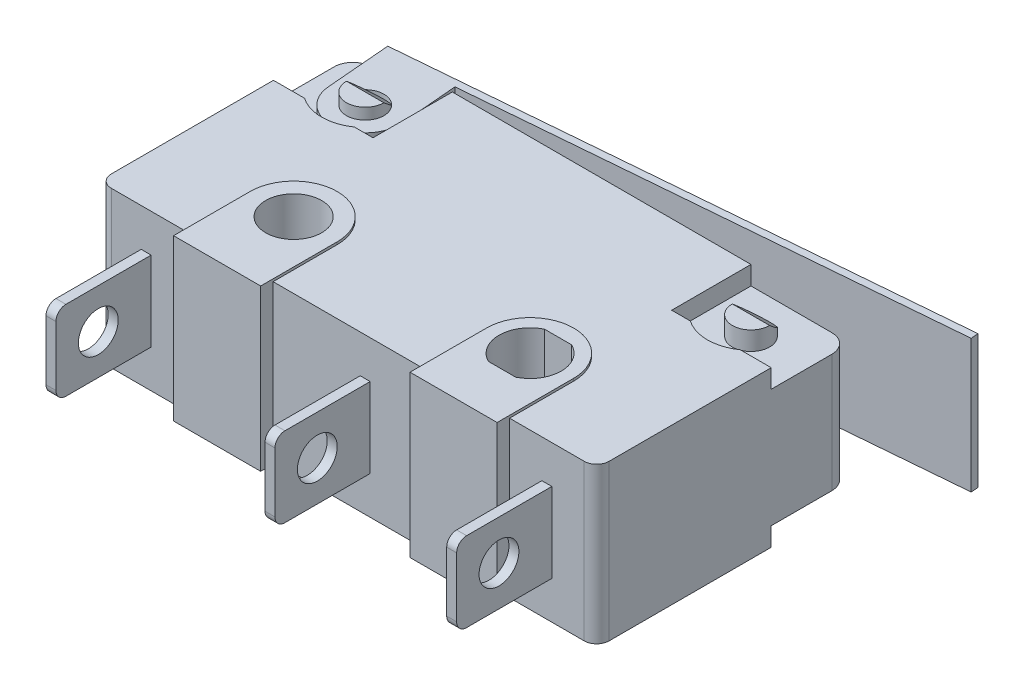
from build123d import *

# Parameters (mm, degrees)
SKETCH1_W             = 20
SKETCH1_H             = 10.2
BOSS_EXTRUDE1_DEPTH   = 6.25
FILLET1_R             = 0.75
FILLET2_R             = 0.5
SKETCH2_R             = 1.125
CUT_EXTRUDE1_DEPTH    = 13.848054327
BOSS_EXTRUDE2_START   = -6.35
SKETCH3_R             = 1.125
BOSS_EXTRUDE2_DEPTH   = 6.45
SKETCH4_R             = 0.75
CUT_EXTRUDE2_DEPTH    = 0.75
CUT_EXTRUDE3_START    = -5.5
SKETCH4_4_R           = 0.75
CUT_EXTRUDE3_DEPTH    = 0.75
CUT_EXTRUDE4_REACH    = 23.718
CUT_EXTRUDE5_START    = -16
CUT_EXTRUDE5_DEPTH    = 4
BOSS_EXTRUDE4_DEPTH   = 1.5
BOSS_EXTRUDE5_START   = 0.3
BOSS_EXTRUDE5_DEPTH   = 5.35
SKETCH10_W            = 0.4
SKETCH10_H            = 3.825
BOSS_EXTRUDE6_DEPTH   = 1.6
BOSS_EXTRUDE6_2_DEPTH = 1.6
BOSS_EXTRUDE6_3_DEPTH = 1.6
SKETCH11_R            = 0.8
CUT_EXTRUDE8_DEPTH    = 24.547231287


with BuildPart() as part:
    # Sketch1 → Boss-Extrude1 (new body)
    with BuildSketch(Plane(origin=(0, 0, 0), x_dir=(1, 0, 0), z_dir=(0, 1, 0))):
        Rectangle(SKETCH1_W, SKETCH1_H)
    extrude(amount=BOSS_EXTRUDE1_DEPTH)

    # Fillet1
    fillet1_edges = [part.edges().sort_by_distance(p)[0] for p in [
        (-10, 3.125, -5.1),
        (10, 3.125, -5.1),
    ]]
    fillet(fillet1_edges, radius=FILLET1_R)

    # Fillet2
    fillet2_edges = [part.edges().sort_by_distance(p)[0] for p in [
        (10, 3.125, 5.1),
        (-10, 3.125, 5.1),
    ]]
    fillet(fillet2_edges, radius=FILLET2_R)

    # Sketch2 → Cut-Extrude1 (cut, through all)
    with BuildSketch(Plane(origin=(0, 6.25, 0), x_dir=(1, 0, 0), z_dir=(0, 1, 0))):
        with Locations(Location((-4.75, -2.525, 0), (0, 0, 270))):
            Circle(SKETCH2_R)
        with BuildLine():
            Line((5.294862368, -1.4), (4.205137632, -1.4))
            ThreePointArc((4.205137632, -1.4), (3.5, -2.525), (4.205137632, -3.65))
            Line((4.205137632, -3.65), (5.294862368, -3.65))
            ThreePointArc((5.294862368, -3.65), (6, -2.525), (5.294862368, -1.4))
        make_face()
    extrude(amount=-CUT_EXTRUDE1_DEPTH, mode=Mode.SUBTRACT)

    # Sketch3 → Boss-Extrude2 (add)
    # profile 1 of 2: a face of its own
    with BuildSketch(Plane(origin=(0, 6.25, 0), x_dir=(1, 0, 0), z_dir=(0, 1, 0)).offset(BOSS_EXTRUDE2_START)):
        with BuildLine():
            Line((-6.5, -5.1), (-6.5, -2.525))
            ThreePointArc((-6.5, -2.525), (-4.75, -0.775), (-3, -2.525))
            Line((-3, -2.525), (-3, -5.1))
            Line((-3, -5.1), (-3, -5.6))
            Line((-3, -5.6), (-6.5, -5.6))
            Line((-6.5, -5.6), (-6.5, -5.1))
        make_face()
        with Locations(Location((-4.75, -2.525, 0), (0, 0, 270))):
            Circle(SKETCH3_R, mode=Mode.SUBTRACT)
    # profile 2 of 2: a face of its own
    with BuildSketch(Plane(origin=(0, 6.25, 0), x_dir=(1, 0, 0), z_dir=(0, 1, 0)).offset(BOSS_EXTRUDE2_START)):
        with BuildLine():
            Line((6.5, -5.6), (6.5, -5.1))
            Line((6.5, -5.1), (6.5, -2.525))
            ThreePointArc((6.5, -2.525), (4.75, -0.775), (3, -2.525))
            Line((3, -2.525), (3, -5.1))
            Line((3, -5.1), (3, -5.6))
            Line((3, -5.6), (6.5, -5.6))
        make_face()
        with BuildLine():
            Line((4.205137632, -3.65), (5.294862368, -3.65))
            ThreePointArc((5.294862368, -3.65), (6, -2.525), (5.294862368, -1.4))
            Line((5.294862368, -1.4), (4.205137632, -1.4))
            ThreePointArc((4.205137632, -1.4), (3.5, -2.525), (4.205137632, -3.65))
        make_face(mode=Mode.SUBTRACT)
    extrude(amount=BOSS_EXTRUDE2_DEPTH)

    # Sketch4 → Cut-Extrude2 (cut)
    # profile 1 of 2: a face of its own
    with BuildSketch(Plane(origin=(0, 6.25, 0), x_dir=(1, 0, 0), z_dir=(0, 1, 0))):
        with BuildLine():
            Line((-6, 1.913859338), (-6, 5.1))
            Line((-6, 5.1), (-9.25, 5.1))
            ThreePointArc((-9.25, 5.1), (-9.780330086, 4.880330086), (-10, 4.35))
            Line((-10, 4.35), (-10, 1.913859338))
            Line((-10, 1.913859338), (-8.75, 1.913859338))
            ThreePointArc((-8.75, 1.913859338), (-7.75, 1.6), (-6.75, 1.913859338))
            Line((-6.75, 1.913859338), (-6, 1.913859338))
        make_face()
        with Locations(Location((-7.75, 3.35, 0), (0, 0, 270))):
            Circle(SKETCH4_R, mode=Mode.SUBTRACT)
    # profile 2 of 2: a face of its own
    with BuildSketch(Plane(origin=(0, 6.25, 0), x_dir=(1, 0, 0), z_dir=(0, 1, 0))):
        with BuildLine():
            Line((9.25, 5.1), (6, 5.1))
            Line((6, 5.1), (6, 1.913859338))
            Line((6, 1.913859338), (6.75, 1.913859338))
            ThreePointArc((6.75, 1.913859338), (7.75, 1.6), (8.75, 1.913859338))
            Line((8.75, 1.913859338), (10, 1.913859338))
            Line((10, 1.913859338), (10, 4.35))
            ThreePointArc((10, 4.35), (9.780330086, 4.880330086), (9.25, 5.1))
        make_face()
        with Locations(Location((7.75, 3.35, 0), (0, 0, 270))):
            Circle(SKETCH4_R, mode=Mode.SUBTRACT)
    extrude(amount=-CUT_EXTRUDE2_DEPTH, mode=Mode.SUBTRACT)

    # Sketch4<4> → Cut-Extrude3 (cut)
    # profile 1 of 2: a face of its own
    with BuildSketch(Plane(origin=(0, 6.25, 0), x_dir=(1, 0, 0), z_dir=(0, 1, 0)).offset(CUT_EXTRUDE3_START)):
        with BuildLine():
            Line((-6, 1.913859338), (-6, 5.1))
            Line((-6, 5.1), (-9.25, 5.1))
            ThreePointArc((-9.25, 5.1), (-9.780330086, 4.880330086), (-10, 4.35))
            Line((-10, 4.35), (-10, 1.913859338))
            Line((-10, 1.913859338), (-8.75, 1.913859338))
            ThreePointArc((-8.75, 1.913859338), (-7.75, 1.6), (-6.75, 1.913859338))
            Line((-6.75, 1.913859338), (-6, 1.913859338))
        make_face()
        with Locations(Location((-7.75, 3.35, 0), (0, 0, 270))):
            Circle(SKETCH4_4_R, mode=Mode.SUBTRACT)
    # profile 2 of 2: a face of its own
    with BuildSketch(Plane(origin=(0, 6.25, 0), x_dir=(1, 0, 0), z_dir=(0, 1, 0)).offset(CUT_EXTRUDE3_START)):
        with BuildLine():
            Line((9.25, 5.1), (6, 5.1))
            Line((6, 5.1), (6, 1.913859338))
            Line((6, 1.913859338), (6.75, 1.913859338))
            ThreePointArc((6.75, 1.913859338), (7.75, 1.6), (8.75, 1.913859338))
            Line((8.75, 1.913859338), (10, 1.913859338))
            Line((10, 1.913859338), (10, 4.35))
            ThreePointArc((10, 4.35), (9.780330086, 4.880330086), (9.25, 5.1))
        make_face()
        with Locations(Location((7.75, 3.35, 0), (0, 0, 270))):
            Circle(SKETCH4_4_R, mode=Mode.SUBTRACT)
    extrude(amount=-CUT_EXTRUDE3_DEPTH, mode=Mode.SUBTRACT)

    # Cut-Extrude4: up to this face of the body (flat: up to its plane)
    cut_extrude4_end = Plane(part.part.faces().sort_by_distance((-6, 5.875, -3.506929669))[0])
    # Sketch5 → Cut-Extrude4 (cut, up to the picked face)
    with BuildSketch(Plane.ZY.offset(10), mode=Mode.PRIVATE) as cut_extrude4_sk1:
        Polygon((-4.1, 6.25), (-4.1, 5.620675277), (-3.35, 6.25), align=None)
    cut_extrude4_tool1 = split(extrude(cut_extrude4_sk1.sketch, amount=-CUT_EXTRUDE4_REACH, mode=Mode.PRIVATE), bisect_by=cut_extrude4_end, keep=Keep.BOTH, mode=Mode.PRIVATE)
    cut_extrude4 = cut_extrude4_tool1.solids().sort_by(Axis((-10, 6.040225, -3.85), (1, 0, 0)))[0]
    add(cut_extrude4, mode=Mode.SUBTRACT)

    # Sketch5<2> → Cut-Extrude5 (cut)
    with BuildSketch(Plane.ZY.offset(10).offset(CUT_EXTRUDE5_START)):
        Polygon((-4.1, 6.25), (-4.1, 5.620675277), (-3.35, 6.25), align=None)
    cut_extrude5 = extrude(amount=-CUT_EXTRUDE5_DEPTH, mode=Mode.SUBTRACT)

    # Mirror2: Cut-Extrude4, Cut-Extrude5 across plane
    add(cut_extrude4.mirror(Plane(origin=(0, 3.125, 0), x_dir=(0, 0, 1), z_dir=(0, -1, 0))), mode=Mode.SUBTRACT)
    add(cut_extrude5.mirror(Plane(origin=(0, 3.125, 0), x_dir=(0, 0, 1), z_dir=(0, -1, 0))), mode=Mode.SUBTRACT)


with BuildPart() as body_2:
    # Sketch6 → Boss-Extrude4 (new, symmetric)
    with BuildSketch(Plane(origin=(0, 3.125, 0), x_dir=(-1, 0, 0), z_dir=(0, -1, 0))):
        with BuildLine():
            Line((2, 5.1), (3.6, 5.1))
            Line((3.6, 5.1), (3.6, 5.3))
            ThreePointArc((3.6, 5.3), (2.8, 6.1), (2, 5.3))
            Line((2, 5.3), (2, 5.1))
        make_face()
    extrude(amount=BOSS_EXTRUDE4_DEPTH, both=True)


with BuildPart() as body_3:
    # Sketch7 → Boss-Extrude5 (new body)
    with BuildSketch(Plane.XZ.offset(-0.75).offset(BOSS_EXTRUDE5_START)):
        with BuildLine():
            Line((5.477048297, -6.804381566), (-6.576261264, -5.782814703))
            Line((-6.576261264, -5.782814703), (-6.379912037, -3.466120511))
            ThreePointArc((-6.379912037, -3.466120511), (-7.633879489, -1.979912037), (-9.120087963, -3.233879489))
            Line((-9.120087963, -3.233879489), (-9.341772575, -5.849501964))
            Line((-9.341772575, -5.849501964), (5.234355633, -7.084887938))
            Line((5.234355633, -7.084887938), (12.519183711, -7.702306659))
            Line((12.519183711, -7.702306659), (12.544519095, -7.403378376))
            Line((12.544519095, -7.403378376), (5.477048297, -6.804381566))
        make_face()
        with BuildLine():
            ThreePointArc((-7, -3.35), (-7.75, -2.6), (-8.5, -3.35))
            ThreePointArc((-8.5, -3.35), (-7.75, -4.1), (-7, -3.35))
        make_face(mode=Mode.SUBTRACT)
    extrude(amount=-BOSS_EXTRUDE5_DEPTH)


with BuildPart() as body_4:
    # Sketch10 → Boss-Extrude6 (new, symmetric)
    with BuildSketch(Plane(origin=(0, 3.125, 0), x_dir=(-1, 0, 0), z_dir=(0, -1, 0))):
        with Locations((-8, -7.0125)):
            Rectangle(SKETCH10_W, SKETCH10_H)
    extrude(amount=BOSS_EXTRUDE6_DEPTH, both=True)


with BuildPart() as body_5:
    # Sketch10 → Boss-Extrude6 2 (new, symmetric)
    with BuildSketch(Plane(origin=(0, 3.125, 0), x_dir=(-1, 0, 0), z_dir=(0, -1, 0))):
        with Locations((-0.7, -7.0125)):
            Rectangle(SKETCH10_W, SKETCH10_H)
    extrude(amount=BOSS_EXTRUDE6_2_DEPTH, both=True)


with BuildPart() as body_6:
    # Sketch10 → Boss-Extrude6 3 (new, symmetric)
    with BuildSketch(Plane(origin=(0, 3.125, 0), x_dir=(-1, 0, 0), z_dir=(0, -1, 0))):
        with Locations((8.1, -7.0125)):
            Rectangle(SKETCH10_W, SKETCH10_H)
    extrude(amount=BOSS_EXTRUDE6_3_DEPTH, both=True)


with BuildPart() as cut_extrude8_tool:
    # Sketch11 → Cut-Extrude8 (new, through all)
    with BuildSketch(Plane.ZY.offset(8.3)):
        with Locations((7.225, 3.125)):
            Circle(SKETCH11_R)
        with BuildLine():
            Line((8.925, 4.725), (8.925, 4.325))
            ThreePointArc((8.925, 4.325), (8.807842712, 4.607842712), (8.525, 4.725))
            Line((8.525, 4.725), (8.925, 4.725))
        make_face()
        with BuildLine():
            Line((8.925, 1.525), (8.525, 1.525))
            ThreePointArc((8.525, 1.525), (8.807842712, 1.642157288), (8.925, 1.925))
            Line((8.925, 1.925), (8.925, 1.525))
        make_face()
    extrude(amount=-CUT_EXTRUDE8_DEPTH)


with BuildPart() as body_4_1:
    add(body_4.part)

    # Cut-Extrude8: cut by cut_extrude8_tool
    add(cut_extrude8_tool.part, mode=Mode.SUBTRACT)


with BuildPart() as body_5_1:
    add(body_5.part)

    # Cut-Extrude8: cut by cut_extrude8_tool
    add(cut_extrude8_tool.part, mode=Mode.SUBTRACT)


with BuildPart() as body_6_1:
    add(body_6.part)

    # Cut-Extrude8: cut by cut_extrude8_tool
    add(cut_extrude8_tool.part, mode=Mode.SUBTRACT)


solid = Compound([part.part, body_2.part, body_3.part, body_4_1.part, body_5_1.part, body_6_1.part])
